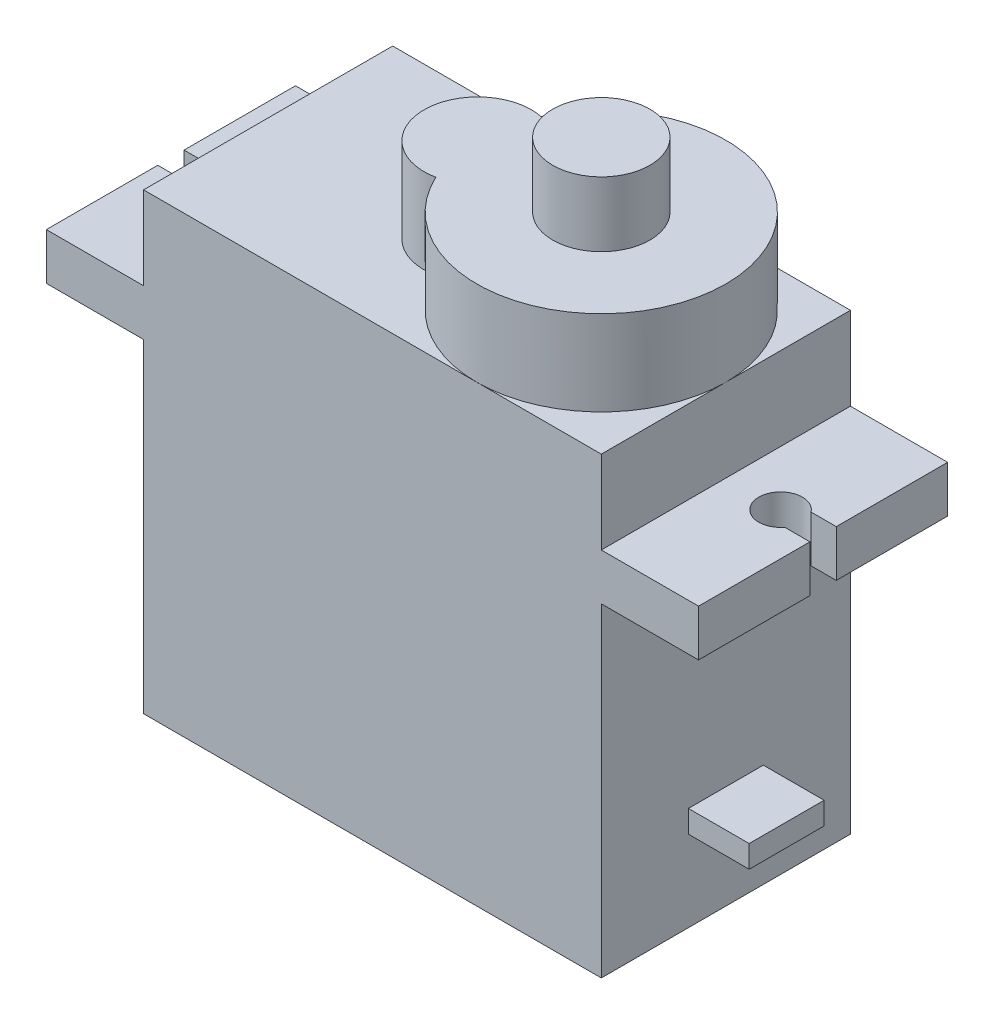
from build123d import *

# Parameters (mm, degrees)
ESBO_O1_W                = 22.6
ESBO_O1_H                = 12.3
RESSALTO_EXTRUS_O1_DEPTH = 22.4
ESBO_O2_W                = 12.3
ESBO_O2_H                = 2.3
RESSALTO_EXTRUS_O2_DEPTH = 4.8
CORTE_EXTRUS_O1_DEPTH    = 26.13806874
RESSALTO_EXTRUS_O3_DEPTH = 4.2
ESBO_O5_R                = 2.4
RESSALTO_EXTRUS_O4_DEPTH = 3.2
ESBO_O6_W                = 3.7
ESBO_O6_H                = 1.1
RESSALTO_EXTRUS_O5_DEPTH = 3


with BuildPart() as part:
    # Esboço1 → Ressalto-extrusão1 (new body)
    with BuildSketch(Plane(origin=(0, 0, 0), x_dir=(1, 0, 0), z_dir=(0, 1, 0))):
        Rectangle(ESBO_O1_W, ESBO_O1_H)
    extrude(amount=RESSALTO_EXTRUS_O1_DEPTH)

    # Esboço2 → Ressalto-extrusão2 (add)
    with BuildSketch(Plane(origin=(11.3, 0, 0), x_dir=(0, 0, -1), z_dir=(1, 0, 0))):
        with Locations((0, 17.15)):
            Rectangle(ESBO_O2_W, ESBO_O2_H)
    ressalto_extrus_o2 = extrude(amount=RESSALTO_EXTRUS_O2_DEPTH)

    # Esboço3 → Corte-extrusão1 (cut, through all)
    with BuildSketch(Plane(origin=(0, 18.3, 0), x_dir=(1, 0, 0), z_dir=(0, 1, 0))):
        with BuildLine():
            Line((14.856227189, 0.65), (16.1, 0.65))
            Line((16.1, 0.65), (16.1, -0.65))
            Line((16.1, -0.65), (14.856227189, -0.65))
            ThreePointArc((14.856227189, -0.65), (12.925, 0), (14.856227189, 0.65))
        make_face()
    corte_extrus_o1 = extrude(amount=-CORTE_EXTRUS_O1_DEPTH, mode=Mode.SUBTRACT)

    # Espelhar1: Ressalto-extrusão2, Corte-extrusão1 across plane
    add(ressalto_extrus_o2.mirror(Plane(origin=(0, 0, 0), x_dir=(0, 0, 1), z_dir=(1, 0, 0))))
    add(corte_extrus_o1.mirror(Plane(origin=(0, 0, 0), x_dir=(0, 0, 1), z_dir=(1, 0, 0))), mode=Mode.SUBTRACT)

    # Esboço4 → Ressalto-extrusão3 (add)
    with BuildSketch(Plane(origin=(0, 22.4, 0), x_dir=(1, 0, 0), z_dir=(0, 1, 0))):
        with BuildLine():
            ThreePointArc((-0.424590164, -2.597391866), (11.3, 0), (-0.424590164, 2.597391866))
            ThreePointArc((-0.424590164, 2.597391866), (-3.6, 0), (-0.424590164, -2.597391866))
        make_face()
    extrude(amount=RESSALTO_EXTRUS_O3_DEPTH)

    # Esboço5 → Ressalto-extrusão4 (add)
    with BuildSketch(Plane(origin=(0, 26.6, 0), x_dir=(1, 0, 0), z_dir=(0, 1, 0))):
        with Locations(Location((5.15, 0, 0), (0, 0, 270))):
            Circle(ESBO_O5_R)
    extrude(amount=RESSALTO_EXTRUS_O4_DEPTH)

    # Esboço6 → Ressalto-extrusão5 (add)
    with BuildSketch(Plane(origin=(11.3, 0, 0), x_dir=(0, 0, -1), z_dir=(1, 0, 0))):
        with Locations((0, 4.55)):
            Rectangle(ESBO_O6_W, ESBO_O6_H)
    extrude(amount=RESSALTO_EXTRUS_O5_DEPTH)


solid = part.part
